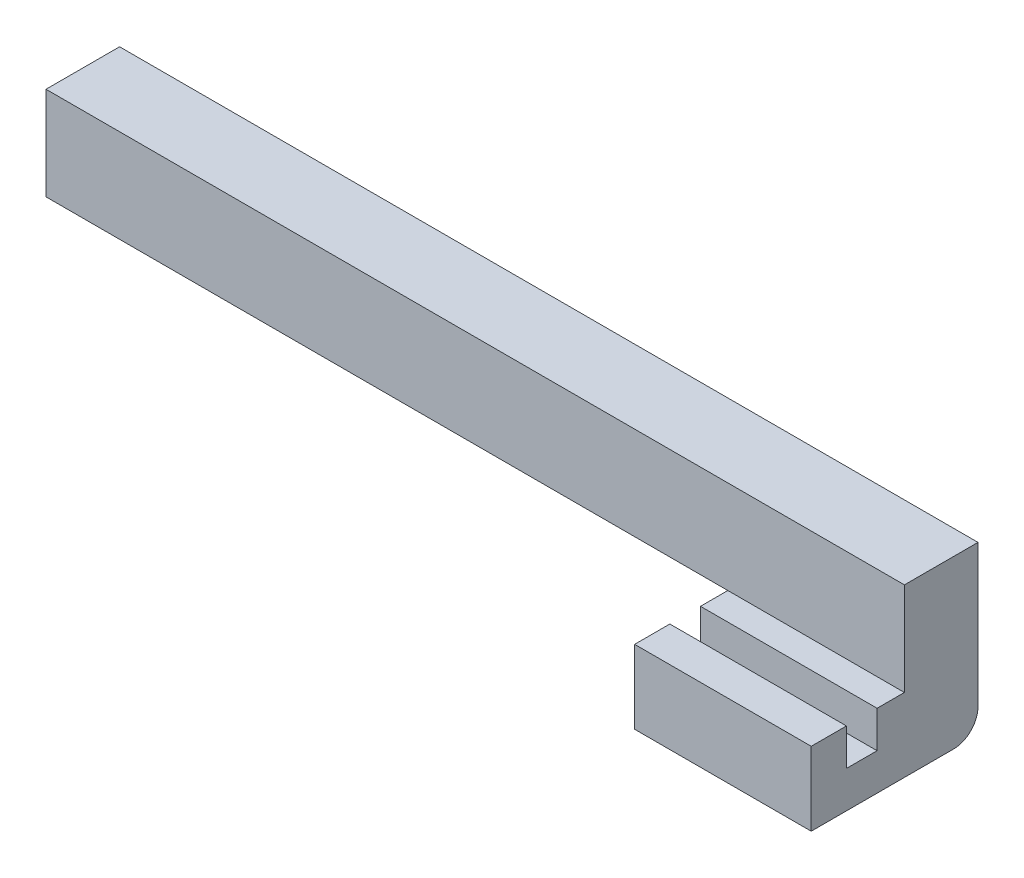
from build123d import *

# Parameters (mm, degrees)
SKETCH1_W           = 7.2
SKETCH1_H           = 3.8
SKETCH1_W_2         = 3.2
SKETCH1_H_2         = 1.25
BOSS_EXTRUDE1_DEPTH = 3
SKETCH6_W           = 13
SKETCH6_H           = 1.25
CUT_EXTRUDE2_DEPTH  = 1.5
BOSS_EXTRUDE2_DEPTH = 3
FILLET1_R           = 1


with BuildPart() as part:
    # Sketch1 → Boss-Extrude1 (new body)
    with BuildSketch(Plane(origin=(0, 0, 0), x_dir=(1, 0, 0), z_dir=(0, 1, 0))):
        Rectangle(SKETCH1_W, SKETCH1_H)
        with Locations((0, 0.16055458)):
            Rectangle(SKETCH1_W_2, SKETCH1_H_2, mode=Mode.SUBTRACT)
    extrude(amount=BOSS_EXTRUDE1_DEPTH)

    # Sketch6 → Cut-Extrude2 (cut)
    with BuildSketch(Plane(origin=(0, 3, 0), x_dir=(1, 0, 0), z_dir=(0, 1, 0))):
        with Locations((1, 0.16055458)):
            Rectangle(SKETCH6_W, SKETCH6_H)
    extrude(amount=-CUT_EXTRUDE2_DEPTH, mode=Mode.SUBTRACT)

    # Sketch7 → Boss-Extrude2 (add)
    with BuildSketch(Plane(origin=(0, 0, -1.9), x_dir=(-1, 0, 0), z_dir=(0, 0, -1))):
        Polygon((-3.6, 0), (3.6, 0), (3.6, 3), (31.4, 3), (31.4, 6.8), (-3.6, 6.8), align=None)
    extrude(amount=BOSS_EXTRUDE2_DEPTH)

    # Fillet1
    fillet1_edges = [part.edges().sort_by_distance(p)[0] for p in [
        (0, 0, -4.9),
    ]]
    fillet(fillet1_edges, radius=FILLET1_R)


solid = part.part
